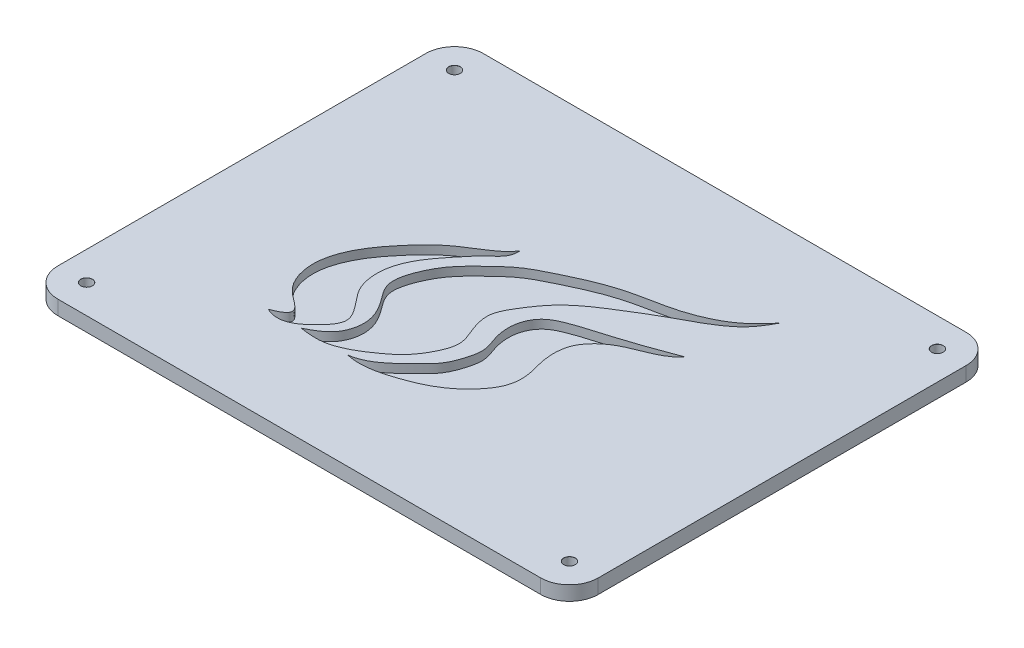
from build123d import *

# Parameters (mm, degrees)
ESBO_O1_W                  = 188
ESBO_O1_H                  = 148
RESSALTO_EXTRUS_O1_DEPTH   = 5
ESBO_O2_W                  = 178
ESBO_O2_H                  = 138
RESSALTO_EXTRUS_O2_DEPTH   = 5
CORTE_EXTRUS_O1_DEPTH      = 3
CORTE_EXTRUS_O2_DEPTH      = 3
CORTE_EXTRUS_O3_START      = 5.999999
CORTE_EXTRUS_O3_DEPTH      = 3.000001
FURO_DE_DI_METRO_4_0_4_1_D = 4
CHANFRO1_SIZE              = 0.025
FILETE1_R                  = 10


with BuildPart() as part:
    # Esboço1 → Ressalto-extrusão1 (new body)
    with BuildSketch(Plane.XZ.offset(5)):
        with Locations((94, -74)):
            Rectangle(ESBO_O1_W, ESBO_O1_H)
    extrude(amount=-RESSALTO_EXTRUS_O1_DEPTH)

    # Esboço2 → Ressalto-extrusão2 (add)
    with BuildSketch(Plane.XZ.offset(5)):
        with Locations((94, -74)):
            Rectangle(ESBO_O2_W, ESBO_O2_H)
    extrude(amount=RESSALTO_EXTRUS_O2_DEPTH)

    # Esboço3 → Corte-extrusão1 (cut)
    with BuildSketch(Plane(origin=(0, 0, 0), x_dir=(-1, 0, 0), z_dir=(0, 1, 0))):
        with BuildLine():
            add(Edge.make_bspline(
                [(-75.851271047, -94.905977801), (-72.853529778, -90.461908235), (-63.518965975, -86.573475907), (-53.388238374, -76.062354108), (-46.202294461, -66.650840181), (-42.933896498, -55.687444915), (-44.842557243, -47.101668287), (-50.660608799, -40.290662898), (-58.64177807, -36.769977477), (-49.631630274, -33.576775134)],
                knots=[0, 0, 0, 0, 0.22173064, 0.36107088, 0.538533699, 0.656521569, 0.776881579, 0.841136845, 1, 1, 1, 1], degree=3))
            add(Edge.make_bspline(
                [(-49.631630274, -33.576775134), (-55.193208686, -30.863794332), (-61.383930126, -35.182265377), (-67.85694371, -43.262736471), (-64.028195245, -49.870932971), (-58.196053752, -55.563823422), (-57.030485514, -66.133339409), (-61.210041506, -75.49236965), (-66.547457609, -81.863728313), (-71.776148718, -88.295991451), (-76.196365931, -90.955926743), (-75.851271047, -94.905977801)],
                knots=[0, 0, 0, 0, 0.190021042, 0.273179635, 0.335508524, 0.444529759, 0.578502017, 0.692991247, 0.817663949, 0.885290163, 1, 1, 1, 1], degree=3))
        make_face()
    extrude(amount=-CORTE_EXTRUS_O1_DEPTH, mode=Mode.SUBTRACT)

    # Esboço4 → Corte-extrusão2 (cut)
    with BuildSketch(Plane(origin=(0, 0, 0), x_dir=(-1, 0, 0), z_dir=(0, 1, 0))):
        with BuildLine():
            add(Edge.make_bspline(
                [(-136.729671692, -91.732742251), (-130.54797809, -89.41900582), (-121.995778776, -86.285522027), (-111.41766579, -83.310038148), (-105.490059757, -81.315624718), (-100.209565482, -78.910124849), (-97.166418624, -73.823248608), (-96.830332763, -68.894438878), (-97.755261853, -63.942155002), (-99.978332244, -59.259888431), (-98.67939373, -53.240415216), (-96.439595754, -47.170244468), (-88.797320177, -40.170304439), (-83.294970154, -34.443536621), (-77.209296676, -33.576775134)],
                knots=[0, 0, 0, 0, 0.208186758, 0.287593338, 0.34598667, 0.40677389, 0.465273363, 0.522640342, 0.558971213, 0.624214432, 0.679618529, 0.747020385, 0.825667459, 1, 1, 1, 1], degree=3))
            add(Edge.make_bspline(
                [(-77.209296676, -33.576775134), (-82.585116536, -32.31898283), (-91.352658464, -34.428249196), (-101.398867055, -38.531561412), (-107.530164378, -43.072555909), (-111.352655789, -47.200724364), (-114.247792048, -51.923301271), (-114.938348234, -56.800502578), (-114.151500445, -61.41688971), (-112.866253897, -65.597847037), (-112.417371236, -70.210515308), (-113.007237755, -74.7648398), (-115.889578157, -79.468708801), (-123.694808489, -85.699371169), (-132.443581982, -86.909139375), (-136.729671692, -91.732742251)],
                knots=[0, 0, 0, 0, 0.166386519, 0.27706617, 0.336739741, 0.403034311, 0.451940723, 0.507330924, 0.55214553, 0.597486466, 0.643567118, 0.69622128, 0.737301428, 0.812802954, 1, 1, 1, 1], degree=3))
        make_face()
    extrude(amount=-CORTE_EXTRUS_O2_DEPTH, mode=Mode.SUBTRACT)

    # Esboço5 → Corte-extrusão3 (cut)
    with BuildSketch(Plane(origin=(0, -8.999999416, 0), x_dir=(1, 0, 0), z_dir=(0, 1, 0)).offset(CORTE_EXTRUS_O3_START)):
        with BuildLine():
            add(Edge.make_bspline(
                [(142.797722166, 118.318760004), (141.55737102, 116.103559652), (139.132967552, 111.773705613), (133.282849534, 107.12676109), (127.016660755, 103.503815432), (120.55072949, 100.15218557), (114.310505573, 96.394806529), (108.124307846, 92.559675632), (102.074067108, 88.493554986), (96.782850849, 83.359171175), (92.821862337, 77.326939474), (88.983167693, 70.724875086), (90.844934858, 63.393230233), (94.274180002, 56.764300619), (91.430089418, 49.523425312), (87.454006301, 43.492143706), (81.590473794, 38.993211516), (75.491955375, 35.081795496), (68.398146179, 32.600302514), (63.514772267, 33.250351232), (61.06257149, 33.576775134)],
                knots=[0, 0, 0, 0, 0.057636738, 0.112657377, 0.168143283, 0.223818375, 0.279375213, 0.335006206, 0.390601607, 0.446300447, 0.501841326, 0.557866933, 0.6118473, 0.666809528, 0.721725073, 0.777322344, 0.83294114, 0.888513668, 0.944016806, 1, 1, 1, 1], degree=3))
            add(Edge.make_bspline(
                [(61.06257149, 33.576775134), (63.70678031, 34.93587517), (68.92788595, 37.619477465), (71.570599658, 46.865300373), (67.920103528, 54.817354375), (61.572954516, 61.557692954), (64.081590616, 70.781691203), (68.213684572, 78.263821244), (74.480339952, 84.318584584), (80.786490273, 90.235655158), (88.573237157, 94.088447273), (96.325623659, 97.780889538), (104.403628291, 100.866438131), (112.828877079, 102.690441809), (121.3012891, 104.295268028), (129.403001338, 107.285492464), (136.990487774, 111.722084003), (140.847014635, 116.10287122), (142.797722166, 118.318760004)],
                knots=[0, 0, 0, 0, 0.062548912, 0.123505555, 0.186160536, 0.247751486, 0.31095589, 0.373508024, 0.436067339, 0.498650764, 0.561041918, 0.62364606, 0.686120194, 0.748656144, 0.811154446, 0.873631853, 0.936080493, 1, 1, 1, 1], degree=3))
        make_face()
    extrude(amount=CORTE_EXTRUS_O3_DEPTH, mode=Mode.SUBTRACT)

    # Furo de diâmetro Ø4.0 (4)1 (through all)
    with Locations(Plane(origin=(0, 0, 0), x_dir=(1, 0, 0), z_dir=(0, 1, 0))):
        with Locations((178, 138), (178, 10), (10, 10), (10, 138)):
            Hole(FURO_DE_DI_METRO_4_0_4_1_D / 2)

    # Chanfro1
    chanfro1_edges = [part.edges().sort_by_distance(p)[0] for p in [
        (12, 0, -138),
        (12, 0, -10),
        (180, 0, -10),
        (180, 0, -138),
    ]]
    chamfer(chanfro1_edges, length=CHANFRO1_SIZE)

    # Filete1
    filete1_edges = [part.edges().sort_by_distance(p)[0] for p in [
        (5, -7.5, -5),
        (5, -7.5, -143),
        (183, -7.5, -143),
        (183, -7.5, -5),
        (0, -2.5, 0),
        (188, -2.5, 0),
        (188, -2.5, -148),
        (0, -2.5, -148),
    ]]
    fillet(filete1_edges, radius=FILETE1_R)


solid = part.part
